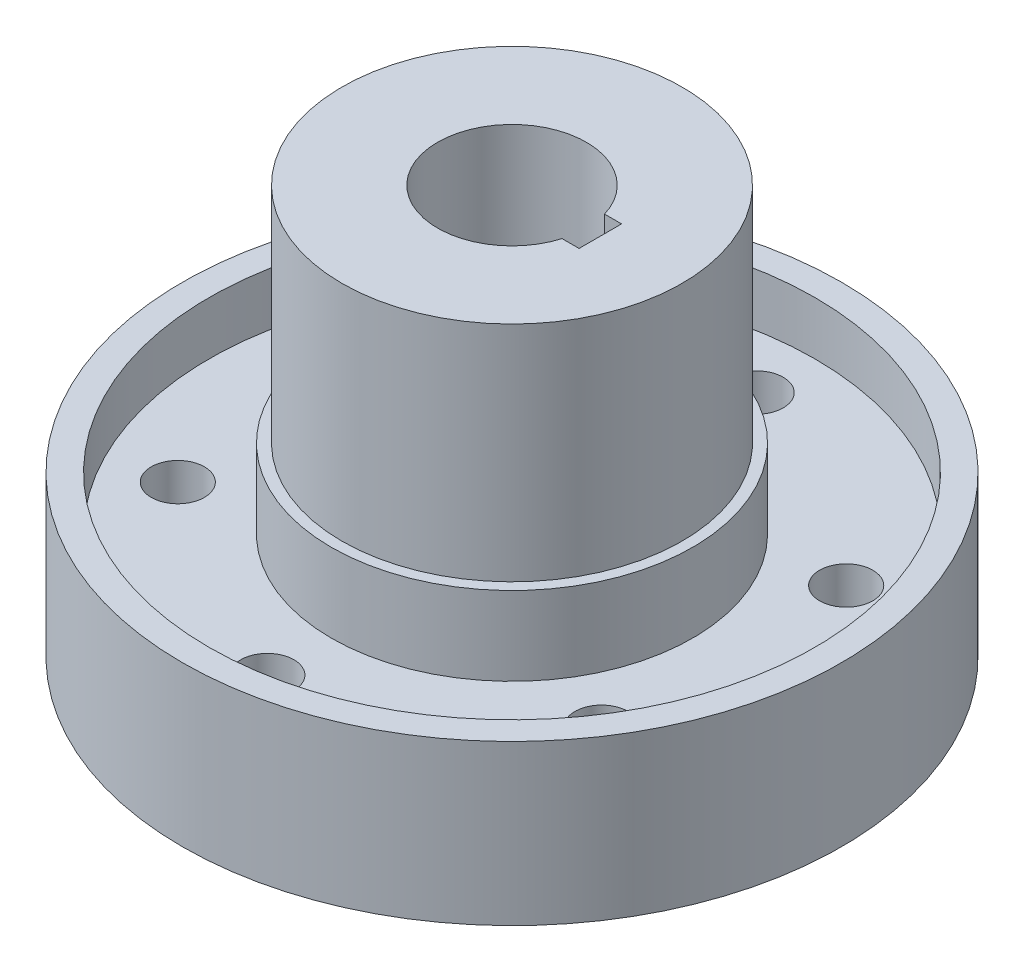
from build123d import *

# Parameters (mm, degrees)
SKETCH1_R               = 155
BOSS_EXTRUDE1_DEPTH     = 75
SKETCH2_R               = 142.5
CUT_EXTRUDE1_DEPTH      = 25
SKETCH3_R               = 85
BOSS_EXTRUDE2_DEPTH     = 37
SKETCH4_R               = 80
BOSS_EXTRUDE3_DEPTH     = 105
CUT_EXTRUDE2_DEPTH      = 292.400068634
CUT_EXTRUDE2_DEPTH_BACK = 292.400068634
SKETCH6_R               = 75
BOSS_EXTRUDE4_DEPTH     = 5
SKETCH7_R               = 60
CUT_EXTRUDE3_DEPTH      = 58
SKETCH8_R               = 12.5
CUT_EXTRUDE4_DEPTH      = 262.178100154


with BuildPart() as part:
    # Sketch1 → Boss-Extrude1 (new body)
    with BuildSketch(Plane(origin=(0, 0, 0), x_dir=(1, 0, 0), z_dir=(0, 1, 0))):
        with Locations(Location((0, 0, 0), (0, 0, 270))):
            Circle(SKETCH1_R)
    extrude(amount=BOSS_EXTRUDE1_DEPTH)

    # Sketch2 → Cut-Extrude1 (cut)
    with BuildSketch(Plane(origin=(0, 75, 0), x_dir=(1, 0, 0), z_dir=(0, 1, 0))):
        with Locations(Location((0, 0, 0), (0, 0, 270))):
            Circle(SKETCH2_R)
    extrude(amount=-CUT_EXTRUDE1_DEPTH, mode=Mode.SUBTRACT)

    # Sketch3 → Boss-Extrude2 (add)
    with BuildSketch(Plane(origin=(0, 50, 0), x_dir=(1, 0, 0), z_dir=(0, 1, 0))):
        with Locations(Location((0, 0, 0), (0, 0, 270))):
            Circle(SKETCH3_R)
    extrude(amount=BOSS_EXTRUDE2_DEPTH)

    # Sketch4 → Boss-Extrude3 (add)
    with BuildSketch(Plane(origin=(0, 87, 0), x_dir=(1, 0, 0), z_dir=(0, 1, 0))):
        with Locations(Location((0, 0, 0), (0, 0, 270))):
            Circle(SKETCH4_R)
    extrude(amount=BOSS_EXTRUDE3_DEPTH)

    # Sketch5 → Cut-Extrude2 (cut, two sides: drawn at the far end of the back side and taken through both)
    with BuildSketch(Plane(origin=(0, 192, 0), x_dir=(1, 0, 0), z_dir=(0, 1, 0)).offset(-CUT_EXTRUDE2_DEPTH_BACK)):
        with BuildLine():
            Line((33.541019662, 10), (41.541019662, 10))
            Line((41.541019662, 10), (41.541019662, -10))
            Line((41.541019662, -10), (33.541019662, -10))
            ThreePointArc((33.541019662, -10), (-35, 0), (33.541019662, 10))
        make_face()
    extrude(amount=CUT_EXTRUDE2_DEPTH + CUT_EXTRUDE2_DEPTH_BACK, mode=Mode.SUBTRACT)

    # Sketch6 → Boss-Extrude4 (add)
    with BuildSketch(Plane.XZ):
        with Locations(Location((0, 0, 0), (0, 0, 90))):
            Circle(SKETCH6_R)
    extrude(amount=BOSS_EXTRUDE4_DEPTH)

    # Sketch7 → Cut-Extrude3 (cut)
    with BuildSketch(Plane.XZ.offset(5)):
        with Locations(Location((0, 0, 0), (0, 0, 270))):
            Circle(SKETCH7_R)
    extrude(amount=-CUT_EXTRUDE3_DEPTH, mode=Mode.SUBTRACT)

    # Sketch8 → Cut-Extrude4 (cut, through all)
    with BuildSketch(Plane(origin=(0, 50, 0), x_dir=(1, 0, 0), z_dir=(0, 1, 0))):
        with Locations(Location((0, 115.062551677, 0), (0, 0, 270))):
            Circle(SKETCH8_R)
        with Locations(Location((99.647092776, 57.531275838, 0), (0, 0, 270))):
            Circle(SKETCH8_R)
        with Locations(Location((99.647092776, -57.531275838, 0), (0, 0, 270))):
            Circle(SKETCH8_R)
        with Locations(Location((0, -115.062551677, 0), (0, 0, 270))):
            Circle(SKETCH8_R)
        with Locations(Location((-99.647092776, -57.531275838, 0), (0, 0, 270))):
            Circle(SKETCH8_R)
        with Locations(Location((-99.647092776, 57.531275838, 0), (0, 0, 270))):
            Circle(SKETCH8_R)
    extrude(amount=-CUT_EXTRUDE4_DEPTH, mode=Mode.SUBTRACT)


solid = part.part
